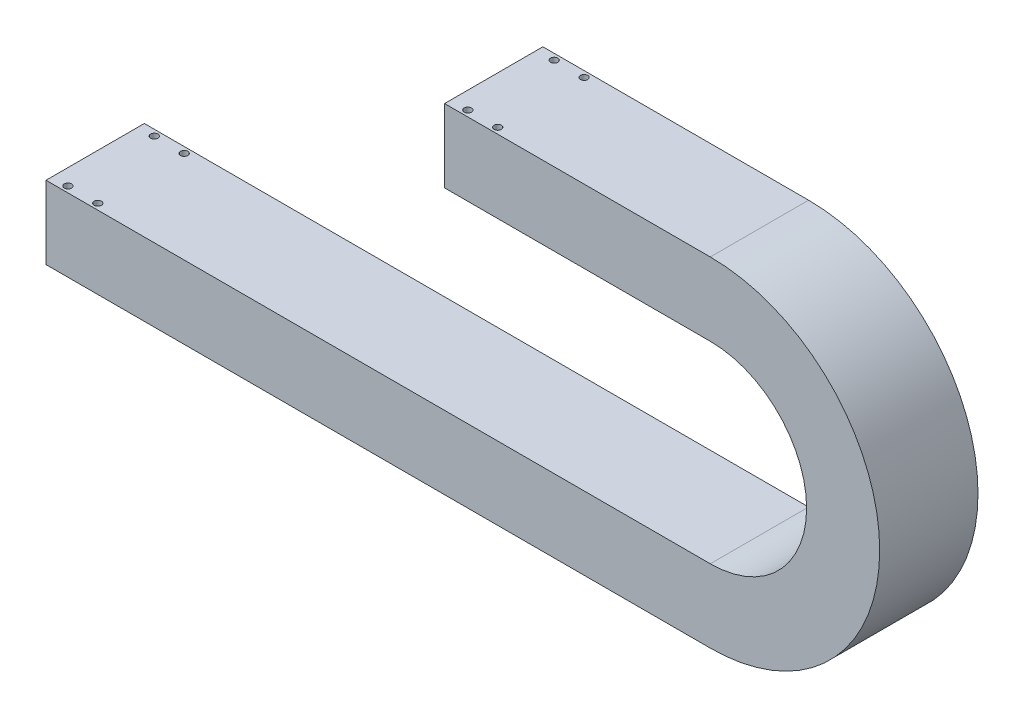
from build123d import *

# Parameters (mm, degrees)
EXTRUDE_1_DEPTH         = 37
SHELL_1_T               = -12
HOLE_WIZARD_M5_2_D      = 5.5
HOLE_WIZARD_M5_1_REACH  = 680.344
HOLE_WIZARD_M5_1_BORE_R = 2.75


with BuildPart() as part:
    # 草图1 → 拉伸-薄壁1 (new, symmetric)
    with BuildSketch(Plane.XY):
        with BuildLine():
            Line((0, -27.5), (500, -27.5))
            ThreePointArc((500, -27.5), (627.5, 100), (500, 227.5))
            Line((500, 227.5), (300, 227.5))
            Line((300, 227.5), (300, 172.5))
            Line((300, 172.5), (500, 172.5))
            ThreePointArc((500, 172.5), (572.5, 100), (500, 27.5))
            Line((500, 27.5), (0, 27.5))
            Line((0, 27.5), (0, -27.5))
        make_face()
    extrude(amount=EXTRUDE_1_DEPTH, both=True)

    # 抽壳1
    shell_1_openings = [part.faces().sort_by_distance(p)[0] for p in [
        (0, 0, 0),
        (300, 200, 0),
    ]]
    offset(amount=SHELL_1_T, openings=shell_1_openings, kind=Kind.INTERSECTION)

    # M5 间隙孔2 (through all)
    with Locations(Plane(origin=(0, 27.5, 0), x_dir=(1, 0, 0), z_dir=(0, 1, 0))):
        with Locations((12, 32.5), (34.5, 32.5), (34.5, -32.5), (12, -32.5)):
            Hole(HOLE_WIZARD_M5_2_D / 2)

    # M5 间隙孔1 bore → M5 间隙孔1 (cut, up to next)
    with BuildSketch(Plane(origin=(0, 227.5, 0), x_dir=(1, 0, 0), z_dir=(0, 1, 0)), mode=Mode.PRIVATE) as hole_wizard_m5_1_sk1:
        with Locations((313, 32.5)):
            Circle(HOLE_WIZARD_M5_1_BORE_R)
    hole_wizard_m5_1_tool1 = extrude(hole_wizard_m5_1_sk1.sketch, amount=-HOLE_WIZARD_M5_1_REACH, mode=Mode.PRIVATE) & part.part
    # M5 间隙孔1 bore → M5 间隙孔1 (cut, up to next)
    with BuildSketch(Plane(origin=(0, 227.5, 0), x_dir=(1, 0, 0), z_dir=(0, 1, 0)), mode=Mode.PRIVATE) as hole_wizard_m5_1_sk2:
        with Locations((335.5, 32.5)):
            Circle(HOLE_WIZARD_M5_1_BORE_R)
    hole_wizard_m5_1_tool2 = extrude(hole_wizard_m5_1_sk2.sketch, amount=-HOLE_WIZARD_M5_1_REACH, mode=Mode.PRIVATE) & part.part
    # M5 间隙孔1 bore → M5 间隙孔1 (cut, up to next)
    with BuildSketch(Plane(origin=(0, 227.5, 0), x_dir=(1, 0, 0), z_dir=(0, 1, 0)), mode=Mode.PRIVATE) as hole_wizard_m5_1_sk3:
        with Locations((335.5, -32.5)):
            Circle(HOLE_WIZARD_M5_1_BORE_R)
    hole_wizard_m5_1_tool3 = extrude(hole_wizard_m5_1_sk3.sketch, amount=-HOLE_WIZARD_M5_1_REACH, mode=Mode.PRIVATE) & part.part
    # M5 间隙孔1 bore → M5 间隙孔1 (cut, up to next)
    with BuildSketch(Plane(origin=(0, 227.5, 0), x_dir=(1, 0, 0), z_dir=(0, 1, 0)), mode=Mode.PRIVATE) as hole_wizard_m5_1_sk4:
        with Locations((313, -32.5)):
            Circle(HOLE_WIZARD_M5_1_BORE_R)
    hole_wizard_m5_1_tool4 = extrude(hole_wizard_m5_1_sk4.sketch, amount=-HOLE_WIZARD_M5_1_REACH, mode=Mode.PRIVATE) & part.part
    add(hole_wizard_m5_1_tool1.solids().sort_by_distance((313, 227.5, -32.5))[0], mode=Mode.SUBTRACT)
    add(hole_wizard_m5_1_tool2.solids().sort_by_distance((335.5, 227.5, -32.5))[0], mode=Mode.SUBTRACT)
    add(hole_wizard_m5_1_tool3.solids().sort_by_distance((335.5, 227.5, 32.5))[0], mode=Mode.SUBTRACT)
    add(hole_wizard_m5_1_tool4.solids().sort_by_distance((313, 227.5, 32.5))[0], mode=Mode.SUBTRACT)


solid = part.part
